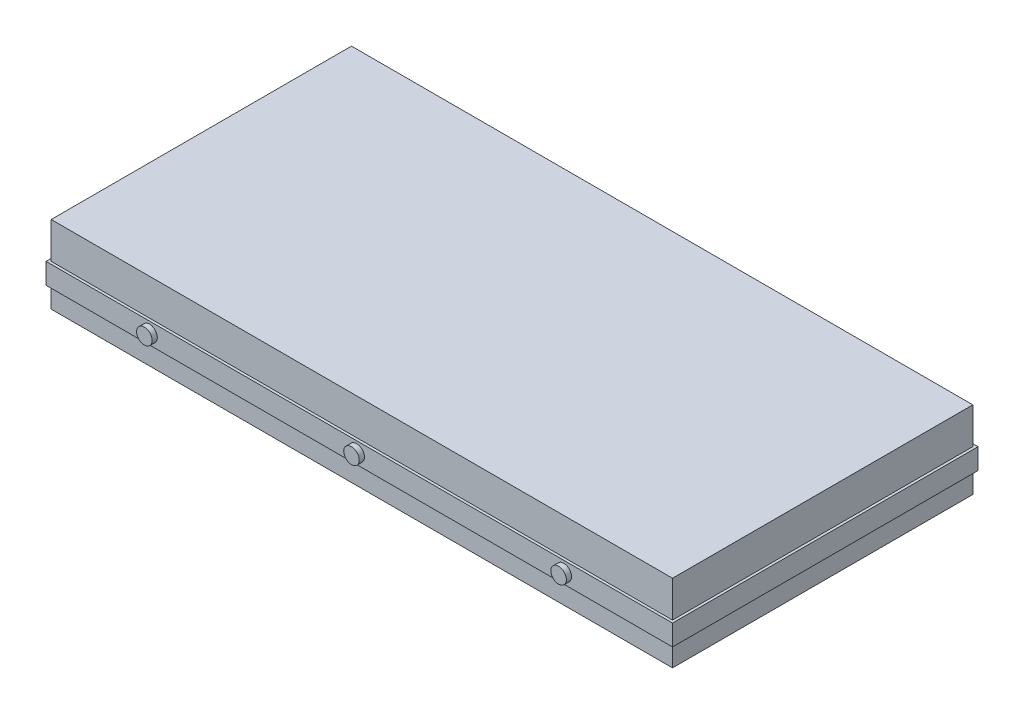
from build123d import *

# Parameters (mm, degrees)
SZKIC1_W                    = 1200
SZKIC1_H                    = 580
DODANIE_WYCI_GNI_CIE1_DEPTH = 150
SZKIC2_W                    = 1210
SZKIC2_H                    = 590
SZKIC2_W_2                  = 1200
SZKIC2_H_2                  = 580
DODANIE_WYCI_GNI_CIE2_DEPTH = 20
SZKIC3_R                    = 15
DODANIE_WYCI_GNI_CIE3_DEPTH = 10
SZYK_LINIOWY1_COUNT         = 3
SZYK_LINIOWY1_PITCH         = 400
LUSTRO1_COPY_1_SKETCH_R     = 15
LUSTRO1_COPY_1_DEPTH        = 10
LUSTRO1_COPY_2_SKETCH_R     = 15
LUSTRO1_COPY_2_DEPTH        = 10


with BuildPart() as part:
    # Szkic1 → Dodanie-wyciągnięcie1 (new body)
    with BuildSketch(Plane(origin=(0, 0, 0), x_dir=(1, 0, 0), z_dir=(0, 1, 0))):
        with Locations((600, 290)):
            Rectangle(SZKIC1_W, SZKIC1_H)
    extrude(amount=DODANIE_WYCI_GNI_CIE1_DEPTH)

    # Szkic2 → Dodanie-wyciągnięcie2 (add, symmetric)
    with BuildSketch(Plane(origin=(0, 60, 0), x_dir=(1, 0, 0), z_dir=(0, 1, 0))):
        with Locations((600, 290)):
            Rectangle(SZKIC2_W, SZKIC2_H)
        with Locations((600, 290)):
            Rectangle(SZKIC2_W_2, SZKIC2_H_2, mode=Mode.SUBTRACT)
    extrude(amount=DODANIE_WYCI_GNI_CIE2_DEPTH, both=True)

    # Szkic3 → Dodanie-wyciągnięcie3 (add)
    with BuildSketch(Plane.XY.offset(5)):
        with Locations(Location((195, 60, 0), (0, 0, 180))):
            Circle(SZKIC3_R)
    dodanie_wyci_gni_cie3 = extrude(amount=DODANIE_WYCI_GNI_CIE3_DEPTH)

    # Szyk liniowy1: Dodanie-wyciągnięcie3 ×3
    with Locations(*[(i * SZYK_LINIOWY1_PITCH, 0, 0) for i in range(1, SZYK_LINIOWY1_COUNT)]):
        add(dodanie_wyci_gni_cie3)

    # Lustro1: Dodanie-wyciągnięcie3 across plane
    add(dodanie_wyci_gni_cie3.mirror(Plane.XY.offset(-290)))

    # Lustro1 copy 1 sketch → Lustro1 copy 1 (add)
    with BuildSketch(Plane(origin=(400, 0, -585), x_dir=(1, 0, 0), z_dir=(0, 0, -1))):
        with Locations((195, -60)):
            Circle(LUSTRO1_COPY_1_SKETCH_R)
    extrude(amount=LUSTRO1_COPY_1_DEPTH)

    # Lustro1 copy 2 sketch → Lustro1 copy 2 (add)
    with BuildSketch(Plane(origin=(800, 0, -585), x_dir=(1, 0, 0), z_dir=(0, 0, -1))):
        with Locations((195, -60)):
            Circle(LUSTRO1_COPY_2_SKETCH_R)
    extrude(amount=LUSTRO1_COPY_2_DEPTH)


solid = part.part
